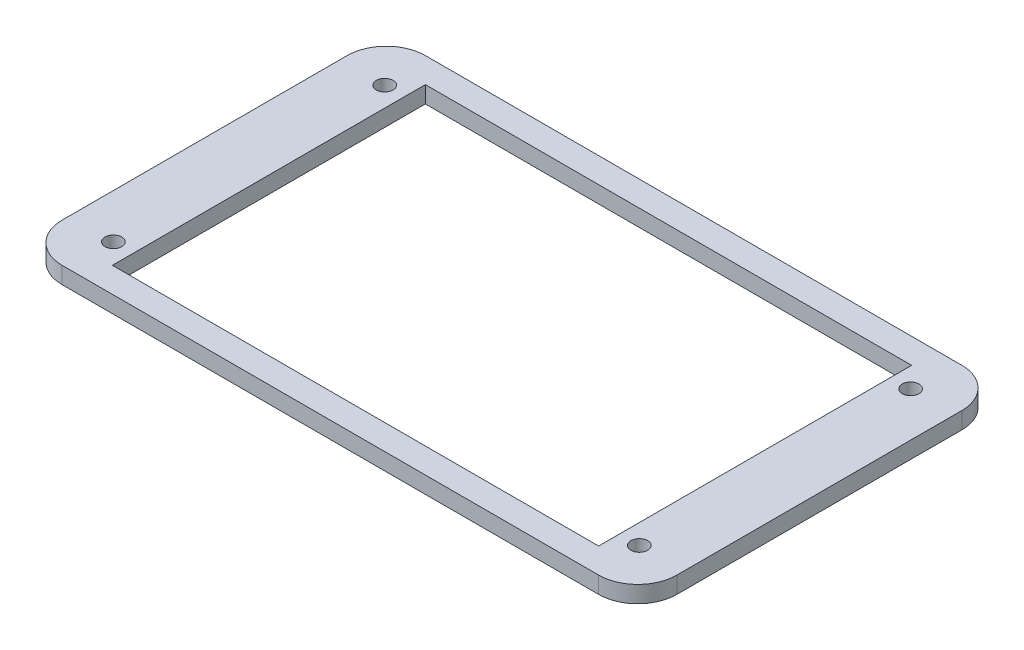
from build123d import *

# Parameters (mm, degrees)
SKETCH1_R           = 1.5
BOSS_EXTRUDE1_DEPTH = 1.5
CUT_EXTRUDE1_REACH  = 65.955
SKETCH2_W           = 87
SKETCH2_H           = 56


with BuildPart() as part:
    # Sketch1 → Boss-Extrude1 (new, symmetric)
    with BuildSketch(Plane(origin=(0, 0, 0), x_dir=(1, 0, 0), z_dir=(0, 1, 0))):
        with BuildLine():
            Line((48, -32.5), (-48, -32.5))
            ThreePointArc((-48, -32.5), (-52.949747468, -30.449747468), (-55, -25.5))
            Line((-55, -25.5), (-55, 25.5))
            ThreePointArc((-55, 25.5), (-52.949747468, 30.449747468), (-48, 32.5))
            Line((-48, 32.5), (48, 32.5))
            ThreePointArc((48, 32.5), (52.949747468, 30.449747468), (55, 25.5))
            Line((55, 25.5), (55, -25.5))
            ThreePointArc((55, -25.5), (52.949747468, -30.449747468), (48, -32.5))
        make_face()
        with Locations(Location((-47.05, 24.27, 0), (0, 0, 270))):
            Circle(SKETCH1_R, mode=Mode.SUBTRACT)
        with Locations(Location((-47.05, -24.27, 0), (0, 0, 270))):
            Circle(SKETCH1_R, mode=Mode.SUBTRACT)
        with Locations(Location((47.05, -24.27, 0), (0, 0, 270))):
            Circle(SKETCH1_R, mode=Mode.SUBTRACT)
        with Locations(Location((47.05, 24.27, 0), (0, 0, 270))):
            Circle(SKETCH1_R, mode=Mode.SUBTRACT)
    extrude(amount=BOSS_EXTRUDE1_DEPTH, both=True)

    # Sketch2 → Cut-Extrude1 (cut, up to next)
    with BuildSketch(Plane(origin=(0, 1.5, 0), x_dir=(1, 0, 0), z_dir=(0, 1, 0)), mode=Mode.PRIVATE) as cut_extrude1_sk1:
        Rectangle(SKETCH2_W, SKETCH2_H)
    cut_extrude1_tool1 = extrude(cut_extrude1_sk1.sketch, amount=-CUT_EXTRUDE1_REACH, mode=Mode.PRIVATE) & part.part
    add(cut_extrude1_tool1.solids().sort_by_distance((0, 1.5, 0))[0], mode=Mode.SUBTRACT)


solid = part.part
